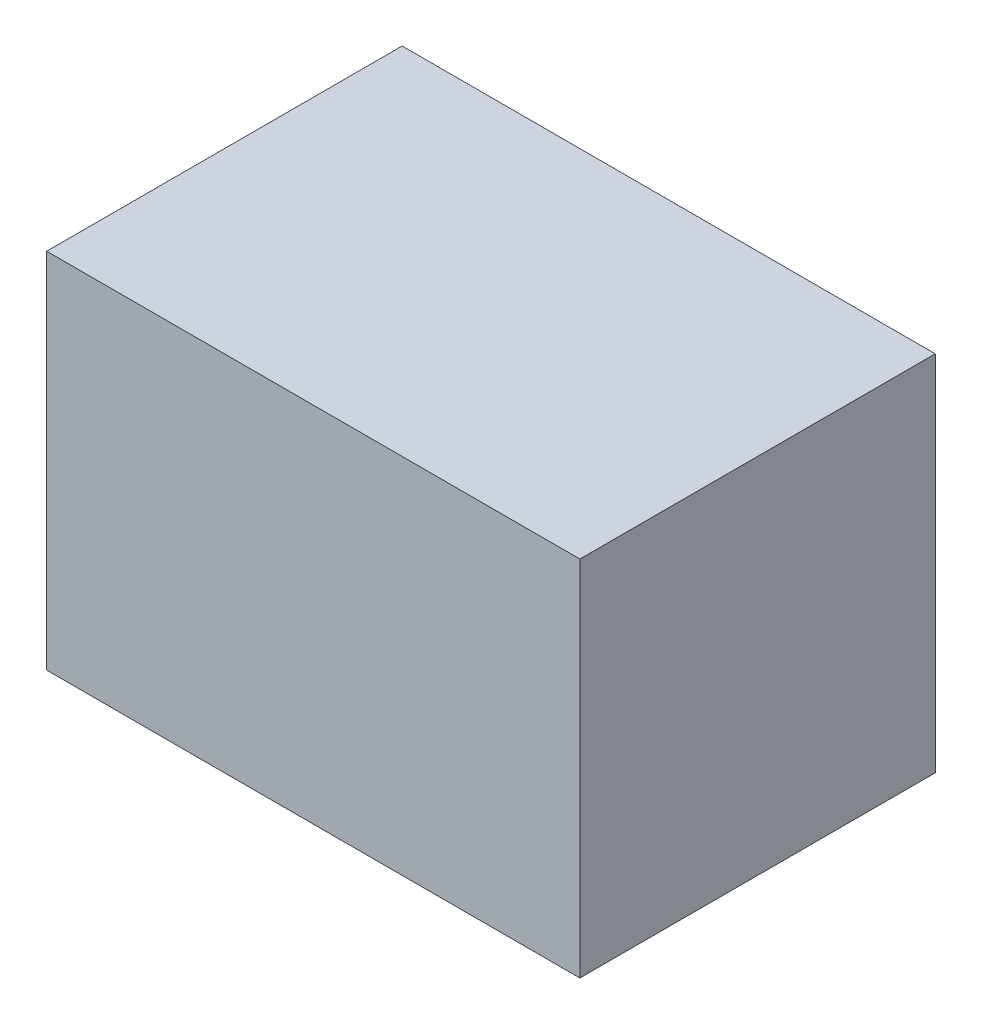
from build123d import *

# Parameters (mm, degrees)
SKETCH1_W           = 72
SKETCH1_H           = 48
BOSS_EXTRUDE1_DEPTH = 24.5


with BuildPart() as part:
    # Sketch1 → Boss-Extrude1 (new, symmetric)
    with BuildSketch(Plane(origin=(0, 0, 0), x_dir=(1, 0, 0), z_dir=(0, 1, 0))):
        Rectangle(SKETCH1_W, SKETCH1_H)
    extrude(amount=BOSS_EXTRUDE1_DEPTH, both=True)


solid = part.part
